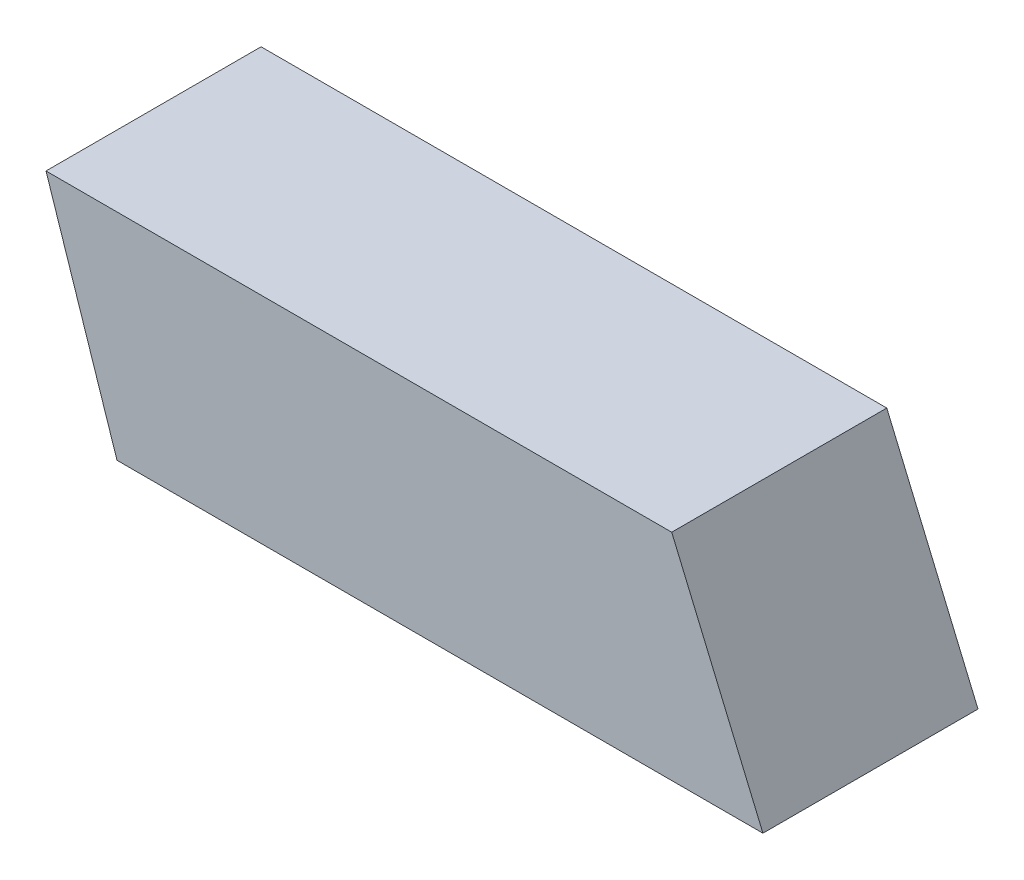
from build123d import *

# Parameters (mm, degrees)
SKETCH_2_W          = 6
SKETCH_2_H          = 6
EXTRUDE_1_DEPTH     = 20
CUT_EXTRUDE_1_DEPTH = 10


with BuildPart() as part:
    # 草图2 → 凸台-拉伸1 (new body)
    with BuildSketch(Plane(origin=(0, 0, 0), x_dir=(0, 0, -1), z_dir=(1, 0, 0))):
        Rectangle(SKETCH_2_W, SKETCH_2_H)
    extrude(amount=EXTRUDE_1_DEPTH)

    # 草图3 → 切除-拉伸1 (cut)
    with BuildSketch(Plane.XY.offset(3)):
        Polygon((0, 3), (1.980777452, -3), (0, -3), align=None)
        Polygon((17.455370963, 3), (20, -3), (20, 3), align=None)
    extrude(amount=-CUT_EXTRUDE_1_DEPTH, mode=Mode.SUBTRACT)


solid = part.part
